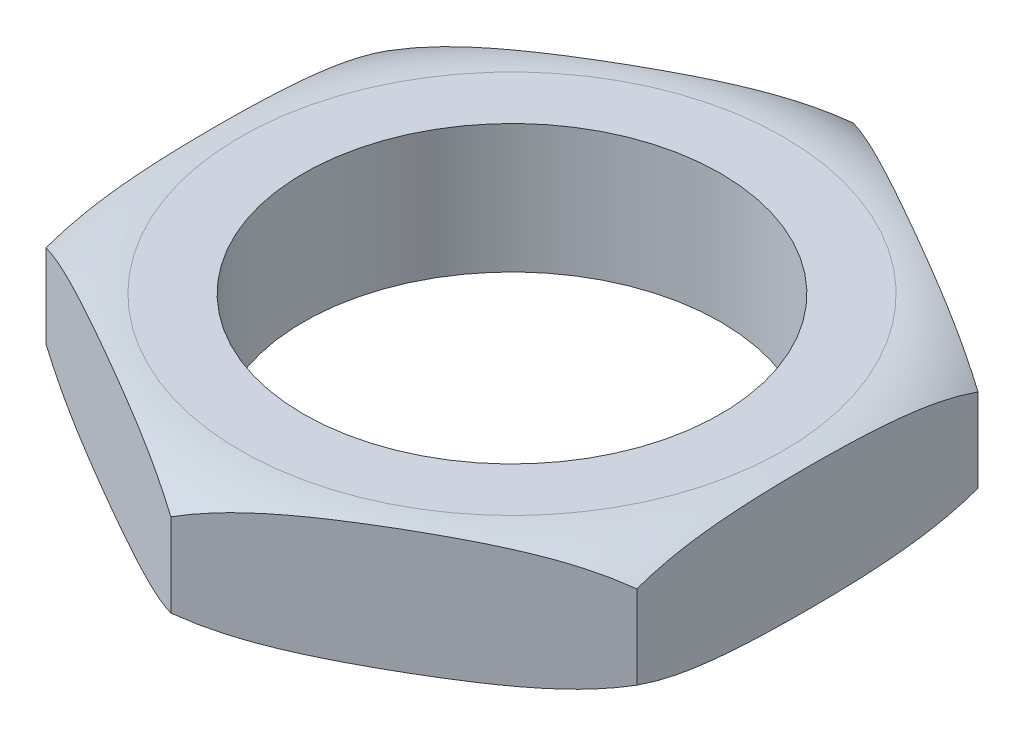
from build123d import *

# Parameters (mm, degrees)
CROQUIS1_R              = 6
SALIENTE_EXTRUIR1_DEPTH = 3.7


with BuildPart() as part:
    # Croquis1 → Saliente-Extruir1 (new body)
    with BuildSketch(Plane(origin=(0, 0, 0), x_dir=(1, 0, 0), z_dir=(0, 1, 0))):
        Polygon((0, 9.814954576), (-8.5, 4.907477288), (-8.5, -4.907477288), (0, -9.814954576), (8.5, -4.907477288), (8.5, 4.907477288), align=None)
        with Locations(Location((0, 0, 0), (0, 0, 270))):
            Circle(CROQUIS1_R, mode=Mode.SUBTRACT)
    extrude(amount=SALIENTE_EXTRUIR1_DEPTH)

    # Croquis2 → Cortar-Revolución1 (revolve, cut)
    with BuildSketch(Plane(origin=(0, 0, 0), x_dir=(0, 0, -1), z_dir=(1, 0, 0))):
        with BuildLine():
            Line((7.814954576, 3.7), (9.814954576, 3.7))
            Line((9.814954576, 3.7), (9.814954576, 3.05))
            ThreePointArc((9.814954576, 3.05), (8.866441618, 3.533421668), (7.814954576, 3.7))
        make_face()
        with BuildLine():
            Line((9.814954576, 0.65), (9.814954576, 0))
            Line((9.814954576, 0), (7.814954576, 0))
            ThreePointArc((7.814954576, 0), (8.866441618, 0.166578332), (9.814954576, 0.65))
        make_face()
    revolve(axis=Axis((0, 0, 0), (0, 1, 0)), mode=Mode.SUBTRACT)


solid = part.part
